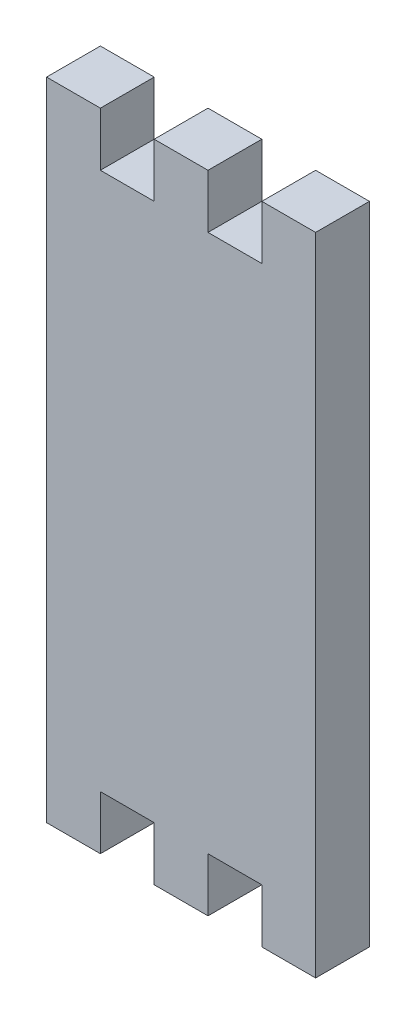
from build123d import *

# Parameters (mm, degrees)
BOSS_EXTRUDE1_DEPTH = 3


with BuildPart() as part:
    # Sketch1 → Boss-Extrude1 (new body)
    with BuildSketch(Plane.XY):
        Polygon((2.416458853, 18.089775561), (5.416458853, 18.089775561), (5.416458853, 15.089775561), (8.416458853, 15.089775561), (8.416458853, 18.089775561), (11.416458853, 18.089775561), (11.416458853, 15.089775561), (14.416458853, 15.089775561), (14.416458853, 18.089775561), (17.416458853, 18.089775561), (17.416458853, -17.910224439), (14.416458853, -17.910224439), (14.416458853, -14.910224439), (11.416458853, -14.910224439), (11.416458853, -17.910224439), (8.416458853, -17.910224439), (8.416458853, -14.910224439), (5.416458853, -14.910224439), (5.416458853, -17.910224439), (2.416458853, -17.910224439), align=None)
    extrude(amount=BOSS_EXTRUDE1_DEPTH)


solid = part.part
